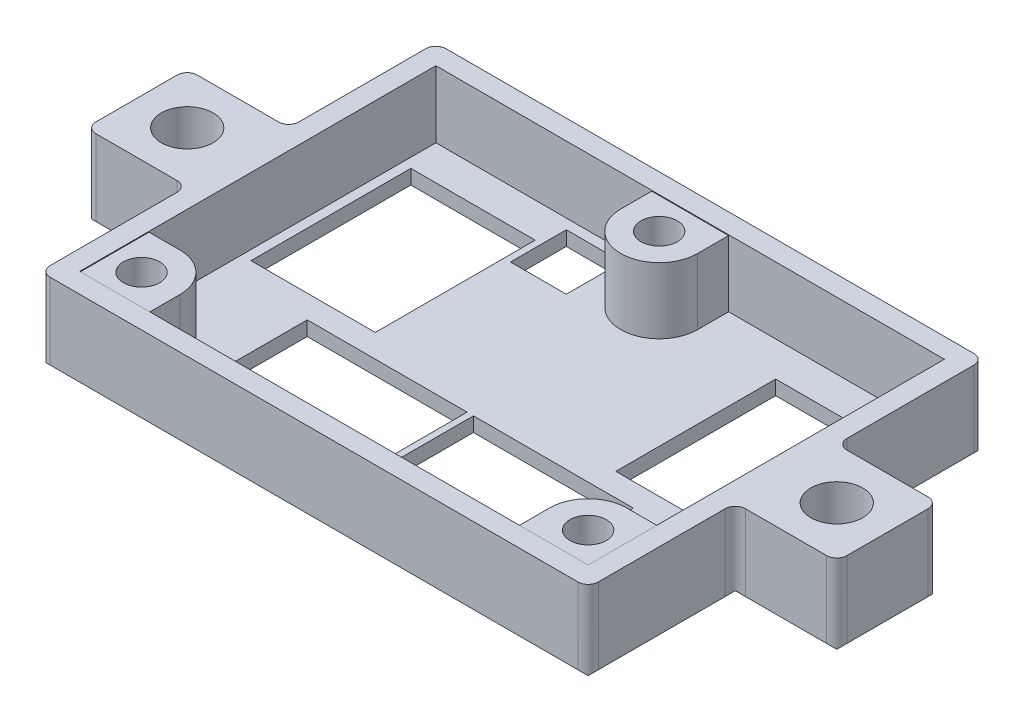
from build123d import *

# Parameters (mm, degrees)
SKETCH1_W           = 54
SKETCH1_H           = 39
SKETCH1_W_2         = 10
SKETCH1_H_2         = 10
SKETCH1_R           = 2.5527
BOSS_EXTRUDE1_DEPTH = 8
SKETCH2_W           = 50.1
SKETCH2_H           = 35.1
CUT_EXTRUDE1_DEPTH  = 0.0762
CUT_EXTRUDE2_DEPTH  = 6.5
SKETCH4_R           = 1.56
CUT_EXTRUDE3_DEPTH  = 43.568023286
SKETCH5_R           = 1.79
CUT_EXTRUDE4_DEPTH  = 2.92
SKETCH6_W           = 12.25
SKETCH6_H           = 15.75
SKETCH6_W_2         = 15.75
SKETCH6_H_2         = 12.5
SKETCH6_W_3         = 5.5
SKETCH6_H_3         = 5.5
CUT_EXTRUDE5_DEPTH  = 43.337883821
CHAMFER1_SIZE       = 0.5
FILLET1_R           = 1


with BuildPart() as part:
    # Sketch1 → Boss-Extrude1 (new body)
    # profile 1 of 3: a face of its own
    with BuildSketch(Plane(origin=(0, 0, 0), x_dir=(1, 0, 0), z_dir=(0, 1, 0))):
        Rectangle(SKETCH1_W, SKETCH1_H)
    # profile 2 of 3: a face of its own
    with BuildSketch(Plane(origin=(0, 0, 0), x_dir=(1, 0, 0), z_dir=(0, 1, 0))):
        with Locations((32, 0)):
            Rectangle(SKETCH1_W_2, SKETCH1_H_2)
        with Locations(Location((32, 0, 0), (0, 0, 270))):
            Circle(SKETCH1_R, mode=Mode.SUBTRACT)
    # profile 3 of 3: a face of its own
    with BuildSketch(Plane(origin=(0, 0, 0), x_dir=(1, 0, 0), z_dir=(0, 1, 0))):
        with Locations((-32, 0)):
            Rectangle(SKETCH1_W_2, SKETCH1_H_2)
        with Locations(Location((-32, 0, 0), (0, 0, 270))):
            Circle(SKETCH1_R, mode=Mode.SUBTRACT)
    extrude(amount=BOSS_EXTRUDE1_DEPTH)

    # Sketch2 → Cut-Extrude1 (cut)
    with BuildSketch(Plane(origin=(0, 8, 0), x_dir=(1, 0, 0), z_dir=(0, 1, 0))):
        Rectangle(SKETCH2_W, SKETCH2_H)
    extrude(amount=-CUT_EXTRUDE1_DEPTH, mode=Mode.SUBTRACT)

    # Sketch3 → Cut-Extrude2 (cut)
    with BuildSketch(Plane(origin=(0, 7.9238, 0), x_dir=(1, 0, 0), z_dir=(0, 1, 0))):
        with BuildLine():
            Line((-3.79, 14.5), (-3.79, 17.55))
            Line((-3.79, 17.55), (-25.05, 17.55))
            Line((-25.05, 17.55), (-25.05, -10.71))
            Line((-25.05, -10.71), (-22, -10.71))
            ThreePointArc((-22, -10.71), (-19.320065299, -11.820065299), (-18.21, -14.5))
            Line((-18.21, -14.5), (-18.21, -17.55))
            Line((-18.21, -17.55), (18.21, -17.55))
            Line((18.21, -17.55), (18.21, -14.5))
            ThreePointArc((18.21, -14.5), (19.320065299, -11.820065299), (22, -10.71))
            Line((22, -10.71), (25.05, -10.71))
            Line((25.05, -10.71), (25.05, 17.55))
            Line((25.05, 17.55), (3.79, 17.55))
            Line((3.79, 17.55), (3.79, 14.5))
            ThreePointArc((3.79, 14.5), (0, 10.71), (-3.79, 14.5))
        make_face()
    extrude(amount=-CUT_EXTRUDE2_DEPTH, mode=Mode.SUBTRACT)

    # Sketch4 → Cut-Extrude3 (cut, through all)
    with BuildSketch(Plane(origin=(0, 7.9238, 0), x_dir=(1, 0, 0), z_dir=(0, 1, 0))):
        with Locations(Location((0, 14.5, 0), (0, 0, 270))):
            Circle(SKETCH4_R)
        with Locations(Location((-22, -14.5, 0), (0, 0, 270))):
            Circle(SKETCH4_R)
        with Locations(Location((22, -14.5, 0), (0, 0, 90))):
            Circle(SKETCH4_R)
    extrude(amount=-CUT_EXTRUDE3_DEPTH, mode=Mode.SUBTRACT)

    # Sketch5 → Cut-Extrude4 (cut)
    with BuildSketch(Plane(origin=(0, 7.9238, 0), x_dir=(1, 0, 0), z_dir=(0, 1, 0))):
        with Locations(Location((0, 14.5, 0), (0, 0, 270))):
            Circle(SKETCH5_R)
        with Locations(Location((-22, -14.5, 0), (0, 0, 270))):
            Circle(SKETCH5_R)
        with Locations(Location((22, -14.5, 0), (0, 0, 90))):
            Circle(SKETCH5_R)
    extrude(amount=-CUT_EXTRUDE4_DEPTH, mode=Mode.SUBTRACT)

    # Sketch6 → Cut-Extrude5 (cut, through all)
    with BuildSketch(Plane(origin=(0, 1.4238, 0), x_dir=(1, 0, 0), z_dir=(0, 1, 0))):
        with Locations((17.975, 6.255)):
            Rectangle(SKETCH6_W, SKETCH6_H)
        with Locations((7.975, -10.15)):
            Rectangle(SKETCH6_W_2, SKETCH6_H_2)
        with Locations((-17.975, 6.255)):
            Rectangle(SKETCH6_W, SKETCH6_H)
        with Locations((-8.4, -10.15)):
            Rectangle(SKETCH6_W_2, SKETCH6_H_2)
        with Locations((-8.45, 13.8)):
            Rectangle(SKETCH6_W_3, SKETCH6_H_3)
    extrude(amount=-CUT_EXTRUDE5_DEPTH, mode=Mode.SUBTRACT)

    # Chamfer1
    chamfer1_edges = [part.edges().sort_by_distance(p)[0] for p in [
        (-27, 0, 12.25),
        (-32, 0, 5),
        (-37, 0, 0),
        (-32, 0, -5),
        (-27, 0, -12.25),
        (0, 0, -19.5),
        (27, 0, -12.25),
        (32, 0, -5),
        (37, 0, 0),
        (32, 0, 5),
        (27, 0, 12.25),
        (0, 0, 19.5),
    ]]
    chamfer(chamfer1_edges, length=CHAMFER1_SIZE)

    # Fillet1
    fillet1_edges = [part.edges().sort_by_distance(p)[0] for p in [
        (-27, 4.25, 19.5),
        (-27, 4.25, 5),
        (-37, 4.25, 5),
        (-37, 4.25, -5),
        (-27, 4.25, -5),
        (-27, 4.25, -19.5),
        (27, 4.25, -19.5),
        (27, 4.25, -5),
        (37, 4.25, -5),
        (37, 4.25, 5),
        (27, 4.25, 5),
        (27, 4.25, 19.5),
    ]]
    fillet(fillet1_edges, radius=FILLET1_R)


solid = part.part
